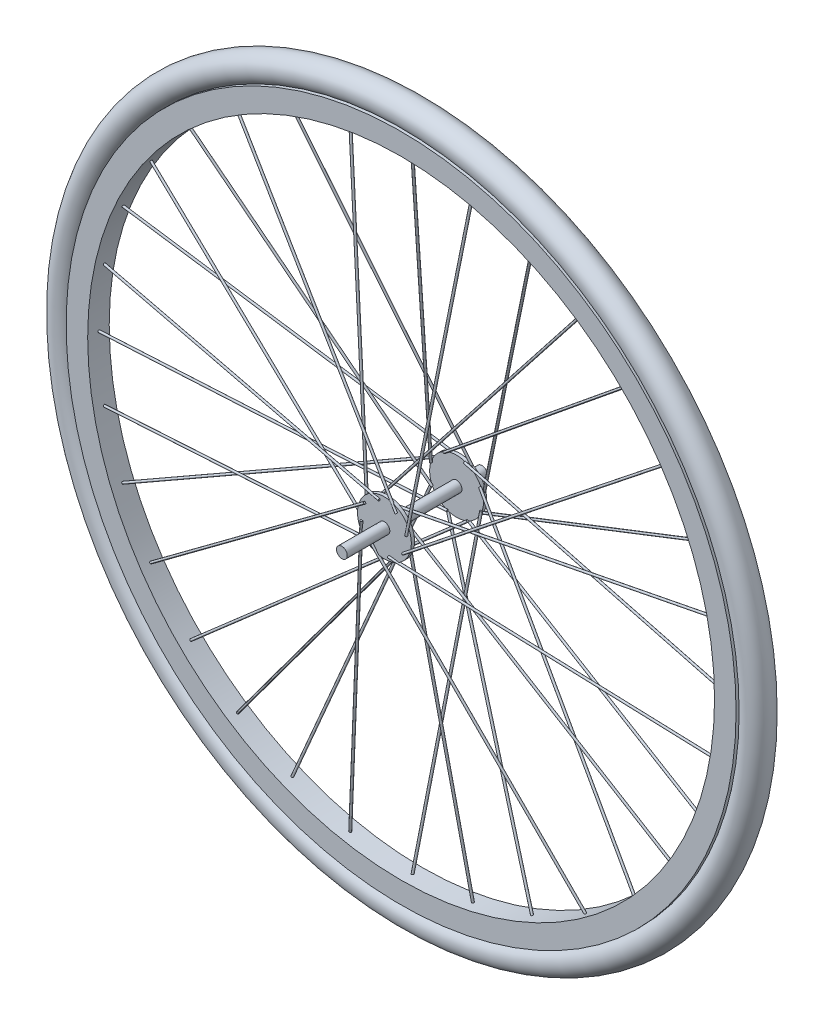
from build123d import *

# Parameters (mm, degrees)
SK_LLANTA_R            = 311
SK_LLANTA_R_2          = 291
LLANTA_DEPTH           = 10
CUBIERTA_PROFILE_R     = 12.5
EJE_PROFILE_R          = 5
PESTANA_IZQ_PROFILE_R  = 25
PESTANA_DCHA_PROFILE_R = 25
RADIO_IZQ_A_PROFILE_R  = 1
RADIO_IZQ_B_PROFILE_R  = 1
RADIO_DCHA_A_PROFILE_R = 1
RADIO_DCHA_B_PROFILE_R = 1
MATRIZ_RADIOS_COUNT    = 8


with BuildPart() as part:
    # Sk_Llanta → Llanta (new, symmetric)
    with BuildSketch(Plane.XY):
        with Locations((-425.1, 65)):
            Circle(SK_LLANTA_R)
        with Locations((-425.1, 65)):
            Circle(SK_LLANTA_R_2, mode=Mode.SUBTRACT)
    extrude(amount=LLANTA_DEPTH, both=True)

    # Cubierta: sweep along a path in Sk_Cubierta
    with BuildLine(Plane.XY) as cubierta_path:
        CenterArc((-425.1, 65), 321.5, 0, 360)
    # Cubierta profile (on start of the path) → Cubierta (sweep)
    with BuildSketch(Plane(origin=(-103.6, 65, 0), x_dir=(0, 0, 1), z_dir=(0, 1, 0))):
        Circle(CUBIERTA_PROFILE_R)
    sweep(path=cubierta_path.line)


with BuildPart() as body_2:
    # Eje: sweep along a curve in space
    with BuildLine() as eje_path:
        Line((-425.1, 65, -65), (-425.1, 65, 65))
    # Eje profile (on start of the path) → Eje (sweep)
    with BuildSketch(Plane(origin=(-425.1, 65, -65), x_dir=(1, 0, 0), z_dir=(0, 0, 1))):
        Circle(EJE_PROFILE_R)
    sweep(path=eje_path.line)

    # Pestana_izq: sweep along a curve in space
    with BuildLine() as pestana_izq_path:
        Line((-425.1, 65, -44.5), (-425.1, 65, -41.5))
    # Pestana_izq profile (on start of the path) → Pestana_izq (sweep)
    with BuildSketch(Plane(origin=(-425.1, 65, -44.5), x_dir=(1, 0, 0), z_dir=(0, 0, 1))):
        Circle(PESTANA_IZQ_PROFILE_R)
    sweep(path=pestana_izq_path.line)

    # Pestana_dcha: sweep along a curve in space
    with BuildLine() as pestana_dcha_path:
        Line((-425.1, 65, 22.5), (-425.1, 65, 25.5))
    # Pestana_dcha profile (on start of the path) → Pestana_dcha (sweep)
    with BuildSketch(Plane(origin=(-425.1, 65, 22.5), x_dir=(1, 0, 0), z_dir=(0, 0, 1))):
        Circle(PESTANA_DCHA_PROFILE_R)
    sweep(path=pestana_dcha_path.line)


with BuildPart() as body_3:
    # Radio_izq_a: sweep along a curve in space
    with BuildLine() as radio_izq_a_path:
        Line((-403.857500277, 65.242499723, -45), (-312.591070885, 336.620582558, 0))
    # Radio_izq_a profile (on start of the path) → Radio_izq_a (sweep)
    with BuildSketch(Plane(origin=(-403.857500277, 65.242499723, -45), x_dir=(0.9478342586580955, -0.31876357714465836, 0), z_dir=(0.31489792678758716, 0.9363398593504757, 0.1552641732545243))):
        Circle(RADIO_IZQ_A_PROFILE_R)
    sweep(path=radio_izq_a_path.line)


with BuildPart() as body_4:
    # Radio_izq_b: sweep along a curve in space
    with BuildLine() as radio_izq_b_path:
        Line((-402.918697886, 75.81618401, -41), (-217.210606331, -142.889393669, 0))
    # Radio_izq_b profile (on start of the path) → Radio_izq_b (sweep)
    with BuildSketch(Plane(origin=(-402.918697886, 75.81618401, -41), x_dir=(-0.7622688406517784, -0.647260546126051, 0), z_dir=(0.6407514067113564, -0.7546031267673518, 0.14146291340967765))):
        Circle(RADIO_IZQ_B_PROFILE_R)
    sweep(path=radio_izq_b_path.line)


with BuildPart() as body_5:
    # Radio_dcha_a: sweep along a curve in space
    with BuildLine() as radio_dcha_a_path:
        Line((-404.347677037, 69.252728837, 26), (-367.743445327, 353.350872439, 0))
    # Radio_dcha_a profile (on start of the path) → Radio_dcha_a (sweep)
    with BuildSketch(Plane(origin=(-404.347677037, 69.252728837, 26), x_dir=(0.9918015957415643, -0.12778730251666956, 0), z_dir=(0.1272641313807081, 0.9877410830202413, -0.09039576194664659))):
        Circle(RADIO_DCHA_A_PROFILE_R)
    sweep(path=radio_dcha_a_path.line)


with BuildPart() as body_6:
    # Radio_dcha_b: sweep along a curve in space
    with BuildLine() as radio_dcha_b_path:
        Line((-408.509413139, 75.796699896, 22), (-180.647933983, -98.337648508, 0))
    # Radio_dcha_b profile (on start of the path) → Radio_dcha_b (sweep)
    with BuildSketch(Plane(origin=(-408.509413139, 75.796699896, 22), x_dir=(0.6072021814160798, 0.7945473622658086, 0), z_dir=(0.7922196933303205, -0.6054233501942224, -0.07648872164716249))):
        Circle(RADIO_DCHA_B_PROFILE_R)
    sweep(path=radio_dcha_b_path.line)


with BuildPart() as matriz_radios_1:
    # Matriz_radios: pattern copy
    add(body_5.part.rotate(Axis((-425.1, 65, 25.5), (0, 0, 1)), 1 * 360 / MATRIZ_RADIOS_COUNT))


with BuildPart() as matriz_radios_2:
    # Matriz_radios: pattern copy
    add(body_5.part.rotate(Axis((-425.1, 65, 25.5), (0, 0, 1)), 2 * 360 / MATRIZ_RADIOS_COUNT))


with BuildPart() as matriz_radios_3:
    # Matriz_radios: pattern copy
    add(body_5.part.rotate(Axis((-425.1, 65, 25.5), (0, 0, 1)), 3 * 360 / MATRIZ_RADIOS_COUNT))


with BuildPart() as matriz_radios_4:
    # Matriz_radios: pattern copy
    add(body_5.part.rotate(Axis((-425.1, 65, 25.5), (0, 0, 1)), 4 * 360 / MATRIZ_RADIOS_COUNT))


with BuildPart() as matriz_radios_5:
    # Matriz_radios: pattern copy
    add(body_5.part.rotate(Axis((-425.1, 65, 25.5), (0, 0, 1)), 5 * 360 / MATRIZ_RADIOS_COUNT))


with BuildPart() as matriz_radios_6:
    # Matriz_radios: pattern copy
    add(body_5.part.rotate(Axis((-425.1, 65, 25.5), (0, 0, 1)), 6 * 360 / MATRIZ_RADIOS_COUNT))


with BuildPart() as matriz_radios_7:
    # Matriz_radios: pattern copy
    add(body_5.part.rotate(Axis((-425.1, 65, 25.5), (0, 0, 1)), 7 * 360 / MATRIZ_RADIOS_COUNT))


with BuildPart() as matriz_radios_8:
    # Matriz_radios: pattern copy
    add(body_6.part.rotate(Axis((-425.1, 65, 25.5), (0, 0, 1)), 1 * 360 / MATRIZ_RADIOS_COUNT))


with BuildPart() as matriz_radios_9:
    # Matriz_radios: pattern copy
    add(body_6.part.rotate(Axis((-425.1, 65, 25.5), (0, 0, 1)), 2 * 360 / MATRIZ_RADIOS_COUNT))


with BuildPart() as matriz_radios_10:
    # Matriz_radios: pattern copy
    add(body_6.part.rotate(Axis((-425.1, 65, 25.5), (0, 0, 1)), 3 * 360 / MATRIZ_RADIOS_COUNT))


with BuildPart() as matriz_radios_11:
    # Matriz_radios: pattern copy
    add(body_6.part.rotate(Axis((-425.1, 65, 25.5), (0, 0, 1)), 4 * 360 / MATRIZ_RADIOS_COUNT))


with BuildPart() as matriz_radios_12:
    # Matriz_radios: pattern copy
    add(body_6.part.rotate(Axis((-425.1, 65, 25.5), (0, 0, 1)), 5 * 360 / MATRIZ_RADIOS_COUNT))


with BuildPart() as matriz_radios_13:
    # Matriz_radios: pattern copy
    add(body_6.part.rotate(Axis((-425.1, 65, 25.5), (0, 0, 1)), 6 * 360 / MATRIZ_RADIOS_COUNT))


with BuildPart() as matriz_radios_14:
    # Matriz_radios: pattern copy
    add(body_6.part.rotate(Axis((-425.1, 65, 25.5), (0, 0, 1)), 7 * 360 / MATRIZ_RADIOS_COUNT))


with BuildPart() as matriz_radios_15:
    # Matriz_radios: pattern copy
    add(body_3.part.rotate(Axis((-425.1, 65, 25.5), (0, 0, 1)), 1 * 360 / MATRIZ_RADIOS_COUNT))


with BuildPart() as matriz_radios_16:
    # Matriz_radios: pattern copy
    add(body_3.part.rotate(Axis((-425.1, 65, 25.5), (0, 0, 1)), 2 * 360 / MATRIZ_RADIOS_COUNT))


with BuildPart() as matriz_radios_17:
    # Matriz_radios: pattern copy
    add(body_3.part.rotate(Axis((-425.1, 65, 25.5), (0, 0, 1)), 3 * 360 / MATRIZ_RADIOS_COUNT))


with BuildPart() as matriz_radios_18:
    # Matriz_radios: pattern copy
    add(body_3.part.rotate(Axis((-425.1, 65, 25.5), (0, 0, 1)), 4 * 360 / MATRIZ_RADIOS_COUNT))


with BuildPart() as matriz_radios_19:
    # Matriz_radios: pattern copy
    add(body_3.part.rotate(Axis((-425.1, 65, 25.5), (0, 0, 1)), 5 * 360 / MATRIZ_RADIOS_COUNT))


with BuildPart() as matriz_radios_20:
    # Matriz_radios: pattern copy
    add(body_3.part.rotate(Axis((-425.1, 65, 25.5), (0, 0, 1)), 6 * 360 / MATRIZ_RADIOS_COUNT))


with BuildPart() as matriz_radios_21:
    # Matriz_radios: pattern copy
    add(body_3.part.rotate(Axis((-425.1, 65, 25.5), (0, 0, 1)), 7 * 360 / MATRIZ_RADIOS_COUNT))


with BuildPart() as matriz_radios_22:
    # Matriz_radios: pattern copy
    add(body_4.part.rotate(Axis((-425.1, 65, 25.5), (0, 0, 1)), 1 * 360 / MATRIZ_RADIOS_COUNT))


with BuildPart() as matriz_radios_23:
    # Matriz_radios: pattern copy
    add(body_4.part.rotate(Axis((-425.1, 65, 25.5), (0, 0, 1)), 2 * 360 / MATRIZ_RADIOS_COUNT))


with BuildPart() as matriz_radios_24:
    # Matriz_radios: pattern copy
    add(body_4.part.rotate(Axis((-425.1, 65, 25.5), (0, 0, 1)), 3 * 360 / MATRIZ_RADIOS_COUNT))


with BuildPart() as matriz_radios_25:
    # Matriz_radios: pattern copy
    add(body_4.part.rotate(Axis((-425.1, 65, 25.5), (0, 0, 1)), 4 * 360 / MATRIZ_RADIOS_COUNT))


with BuildPart() as matriz_radios_26:
    # Matriz_radios: pattern copy
    add(body_4.part.rotate(Axis((-425.1, 65, 25.5), (0, 0, 1)), 5 * 360 / MATRIZ_RADIOS_COUNT))


with BuildPart() as matriz_radios_27:
    # Matriz_radios: pattern copy
    add(body_4.part.rotate(Axis((-425.1, 65, 25.5), (0, 0, 1)), 6 * 360 / MATRIZ_RADIOS_COUNT))


with BuildPart() as matriz_radios_28:
    # Matriz_radios: pattern copy
    add(body_4.part.rotate(Axis((-425.1, 65, 25.5), (0, 0, 1)), 7 * 360 / MATRIZ_RADIOS_COUNT))


solid = Compound([part.part, body_2.part, body_3.part, body_4.part, body_5.part, body_6.part, matriz_radios_1.part, matriz_radios_2.part, matriz_radios_3.part, matriz_radios_4.part, matriz_radios_5.part, matriz_radios_6.part, matriz_radios_7.part, matriz_radios_8.part, matriz_radios_9.part, matriz_radios_10.part, matriz_radios_11.part, matriz_radios_12.part, matriz_radios_13.part, matriz_radios_14.part, matriz_radios_15.part, matriz_radios_16.part, matriz_radios_17.part, matriz_radios_18.part, matriz_radios_19.part, matriz_radios_20.part, matriz_radios_21.part, matriz_radios_22.part, matriz_radios_23.part, matriz_radios_24.part, matriz_radios_25.part, matriz_radios_26.part, matriz_radios_27.part, matriz_radios_28.part])
